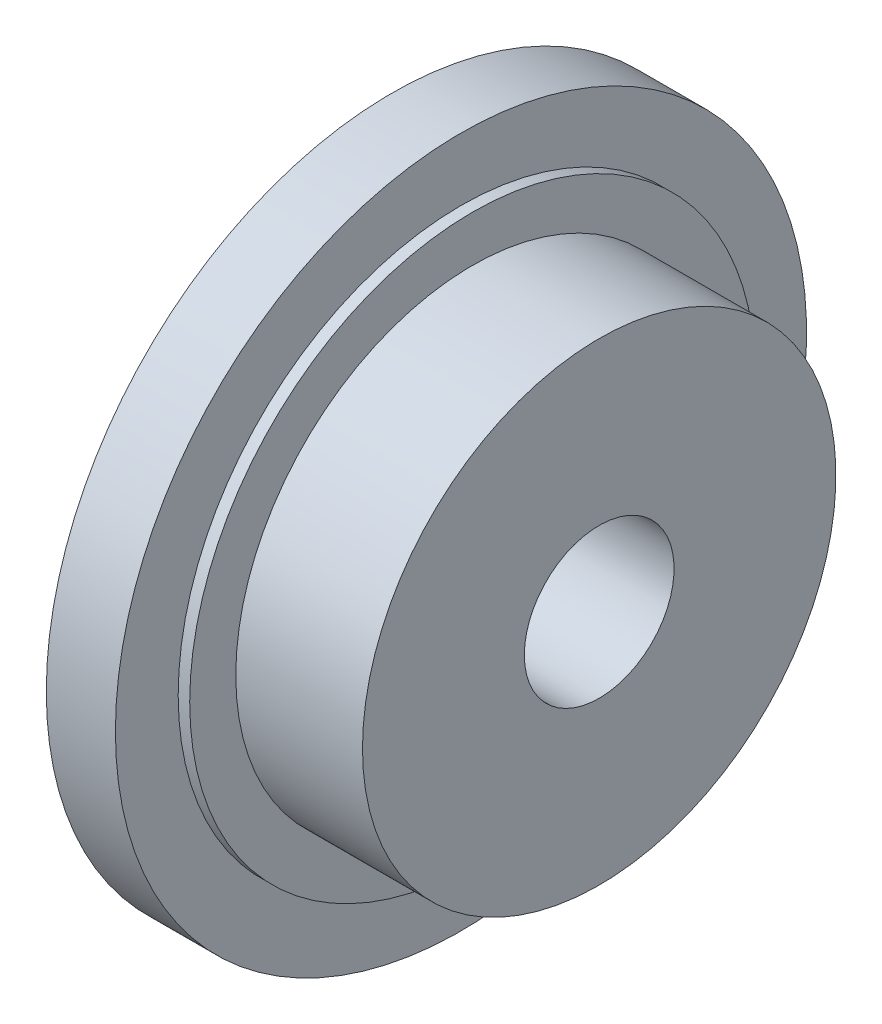
from build123d import *

# Parameters (mm, degrees)
SKETCH2_R          = 2.5
CUT_EXTRUDE1_DEPTH = 4.5
SKETCH4_R          = 8.5
CUT_EXTRUDE3_DEPTH = 2


with BuildPart() as part:
    # Sketch1 → Revolve1 (revolve)
    with BuildSketch(Plane.XY, mode=Mode.PRIVATE) as revolve1_sk:
        Polygon((0, 30), (6, 30), (6, 24.55), (7, 24.55), (7, 20.55), (18, 20.55), (18, 6.5), (6, 6.5), (6, 7.5), (0, 7.5), align=None)
    revolve(revolve1_sk.sketch.rotate(Axis((0, 0, 0), (1, 0, 0)), 90), axis=Axis((0, 0, 0), (1, 0, 0)))

    # Sketch2 → Cut-Extrude1 (cut)
    with BuildSketch(Plane.ZY):
        with Locations((0, 20)):
            Circle(SKETCH2_R)
        with Locations((17.320508076, 10)):
            Circle(SKETCH2_R)
        with Locations((17.320508076, -10)):
            Circle(SKETCH2_R)
        with Locations((0, -20)):
            Circle(SKETCH2_R)
        with Locations((-17.320508076, -10)):
            Circle(SKETCH2_R)
        with Locations((-17.320508076, 10)):
            Circle(SKETCH2_R)
    extrude(amount=-CUT_EXTRUDE1_DEPTH, mode=Mode.SUBTRACT)

    # Sketch4 → Cut-Extrude3 (cut)
    with BuildSketch(Plane.ZY):
        Circle(SKETCH4_R)
    extrude(amount=-CUT_EXTRUDE3_DEPTH, mode=Mode.SUBTRACT)


solid = part.part
